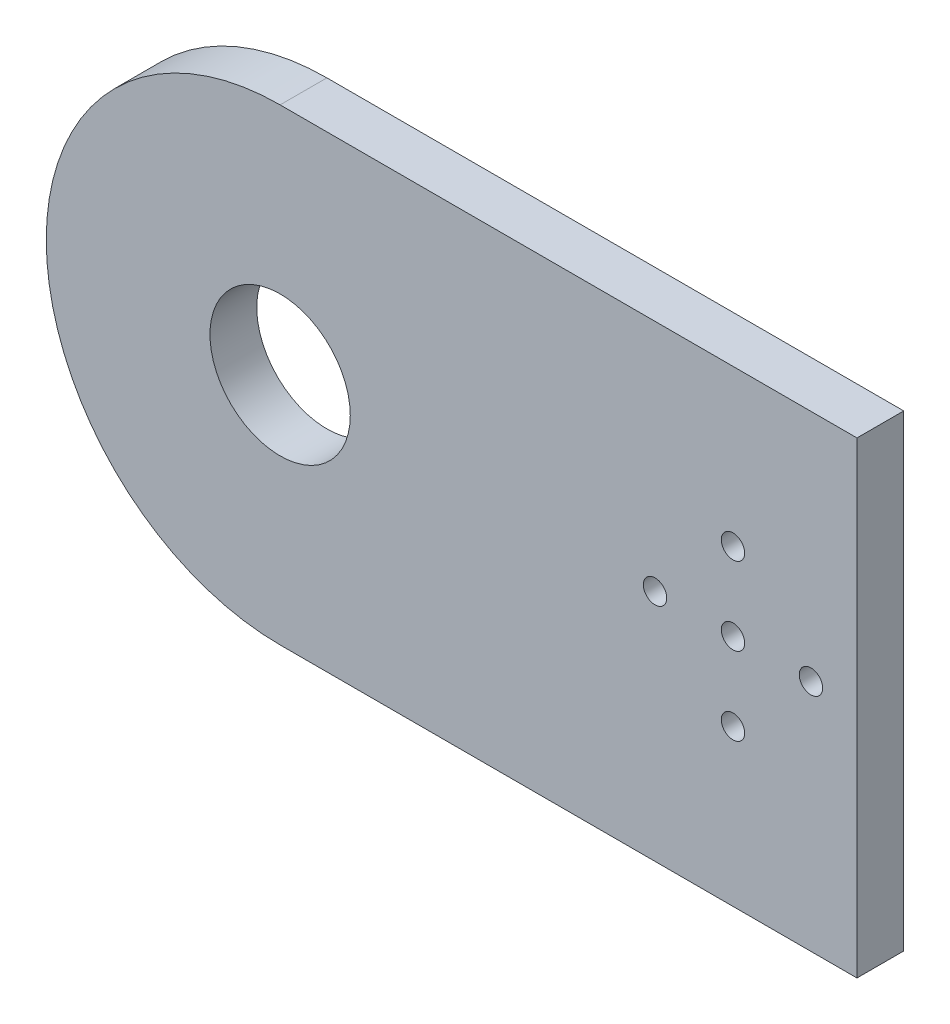
from build123d import *

# Parameters (mm, degrees)
SALIENTE_EXTRUIR1_DEPTH = 6
CROQUIS2_R              = 1.5
CORTAR_EXTRUIR1_DEPTH   = 74.654599313
CROQUIS3_R              = 9
CORTAR_EXTRUIR2_DEPTH   = 74.654599313


with BuildPart() as part:
    # Croquis1 → Saliente-Extruir1 (new body)
    with BuildSketch(Plane.XY):
        with BuildLine():
            Line((-37, 30), (37, 30))
            Line((37, 30), (37, -30))
            Line((37, -30), (-37, -30))
            ThreePointArc((-37, -30), (-67, 0), (-37, 30))
        make_face()
    extrude(amount=SALIENTE_EXTRUIR1_DEPTH)

    # Croquis2 → Cortar-Extruir1 (cut, through all)
    with BuildSketch(Plane.XY.offset(6)):
        with Locations((21.0941, -10)):
            Circle(CROQUIS2_R)
        with Locations((21.0941, 0)):
            Circle(CROQUIS2_R)
        with Locations((21.0941, 10)):
            Circle(CROQUIS2_R)
        with Locations((31.0941, 0)):
            Circle(CROQUIS2_R)
        with Locations((11.0941, 0)):
            Circle(CROQUIS2_R)
    extrude(amount=-CORTAR_EXTRUIR1_DEPTH, mode=Mode.SUBTRACT)

    # Croquis3 → Cortar-Extruir2 (cut, through all)
    with BuildSketch(Plane.XY.offset(6)):
        with Locations((-37, 0)):
            Circle(CROQUIS3_R)
    extrude(amount=-CORTAR_EXTRUIR2_DEPTH, mode=Mode.SUBTRACT)


solid = part.part
